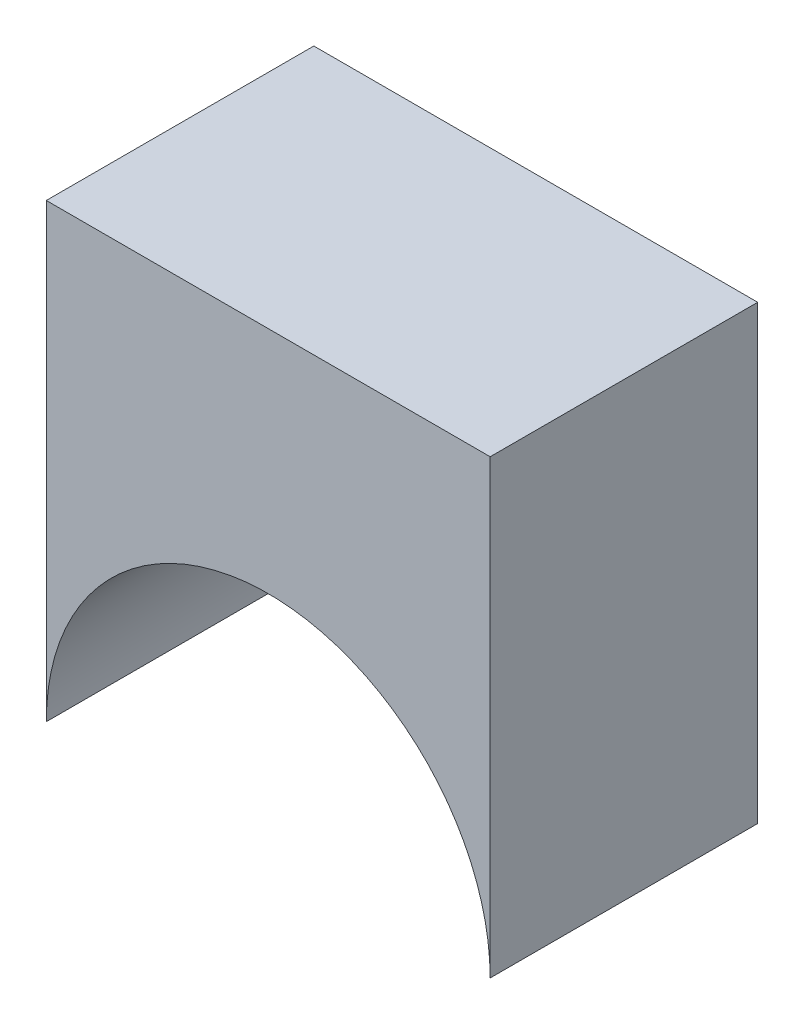
from build123d import *

# Parameters (mm, degrees)
SKETCH1_W           = 37
SKETCH1_H           = 22.3
BOSS_EXTRUDE1_DEPTH = 19.13
BOSS_EXTRUDE2_DEPTH = 22.3


with BuildPart() as part:
    # Sketch1 → Boss-Extrude1 (new body)
    with BuildSketch(Plane(origin=(0, 0, 0), x_dir=(1, 0, 0), z_dir=(0, 1, 0))):
        Rectangle(SKETCH1_W, SKETCH1_H)
    extrude(amount=BOSS_EXTRUDE1_DEPTH)

    # Sketch2 → Boss-Extrude2 (add)
    with BuildSketch(Plane.XY.offset(11.15)):
        with BuildLine():
            Line((4e-09, 0), (-18.5, 0))
            Line((-18.5, 0), (-18.5, -18.5))
            ThreePointArc((-18.5, -18.5), (-13.081475451, -5.418524547), (4e-09, 0))
        make_face()
        with BuildLine():
            Line((18.5, 0), (4e-09, 0))
            ThreePointArc((4e-09, 0), (13.081475453, -5.418524549), (18.5, -18.5))
            Line((18.5, -18.5), (18.5, 0))
        make_face()
    extrude(amount=-BOSS_EXTRUDE2_DEPTH)


solid = part.part
